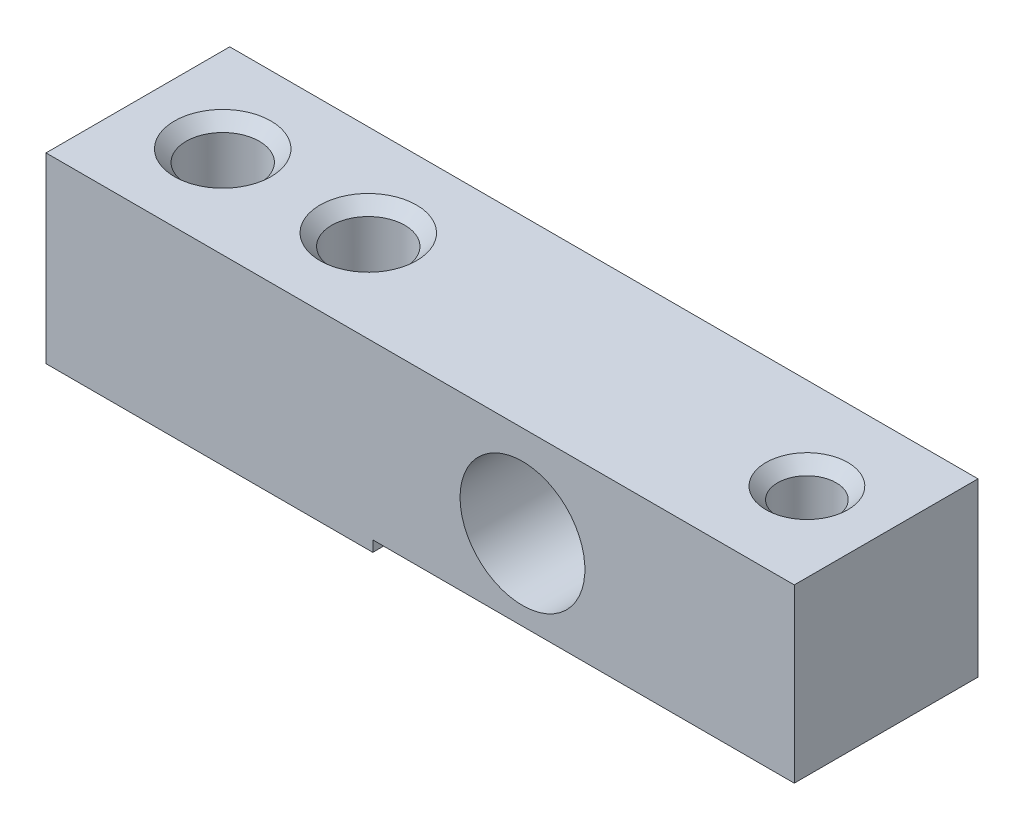
from build123d import *

# Parameters (mm, degrees)
SKETCH1_W           = 31.9024
SKETCH1_H           = 31.6992
BOSS_EXTRUDE1_DEPTH = 129.921
SKETCH2_W           = 73.1774
SKETCH2_H           = 31.9024
CUT_EXTRUDE1_DEPTH  = 1.8796
SKETCH4_R           = 6.35
SKETCH4_R_2         = 5.08
CUT_EXTRUDE2_DEPTH  = 135.68016299
CHAMFER2_SIZE       = 2.032
SKETCH9_R           = 10.836935607
CUT_EXTRUDE3_DEPTH  = 135.716143008


with BuildPart() as part:
    # Sketch1 → Boss-Extrude1 (new body)
    with BuildSketch(Plane(origin=(0, 0, 0), x_dir=(0, 0, -1), z_dir=(1, 0, 0))):
        Rectangle(SKETCH1_W, SKETCH1_H)
    extrude(amount=BOSS_EXTRUDE1_DEPTH)

    # Sketch2 → Cut-Extrude1 (cut)
    with BuildSketch(Plane.XZ.offset(15.8496)):
        with Locations((93.3323, 0)):
            Rectangle(SKETCH2_W, SKETCH2_H)
    extrude(amount=-CUT_EXTRUDE1_DEPTH, mode=Mode.SUBTRACT)

    # Sketch4 → Cut-Extrude2 (cut, through all)
    with BuildSketch(Plane(origin=(0, 15.8496, 0), x_dir=(1, 0, 0), z_dir=(0, 1, 0))):
        with Locations(Location((40.005, 0, 0), (0, 0, 270))):
            Circle(SKETCH4_R)
        with Locations(Location((14.732, 0, 0), (0, 0, 270))):
            Circle(SKETCH4_R)
        with Locations(Location((116.1669, 0, 0), (0, 0, 270))):
            Circle(SKETCH4_R_2)
    extrude(amount=-CUT_EXTRUDE2_DEPTH, mode=Mode.SUBTRACT)

    # Chamfer2
    chamfer2_edges = [part.edges().sort_by_distance(p)[0] for p in [
        (116.1669, 15.8496, -5.08),
        (14.732, 15.8496, -6.35),
        (40.005, 15.8496, -6.35),
    ]]
    chamfer(chamfer2_edges, length=CHAMFER2_SIZE)

    # Sketch9 → Cut-Extrude3 (cut, through all)
    with BuildSketch(Plane(origin=(0, 0, -15.9512), x_dir=(-1, 0, 0), z_dir=(0, 0, -1))):
        with Locations((-82.727824096, 0)):
            Circle(SKETCH9_R)
    extrude(amount=-CUT_EXTRUDE3_DEPTH, mode=Mode.SUBTRACT)


solid = part.part
